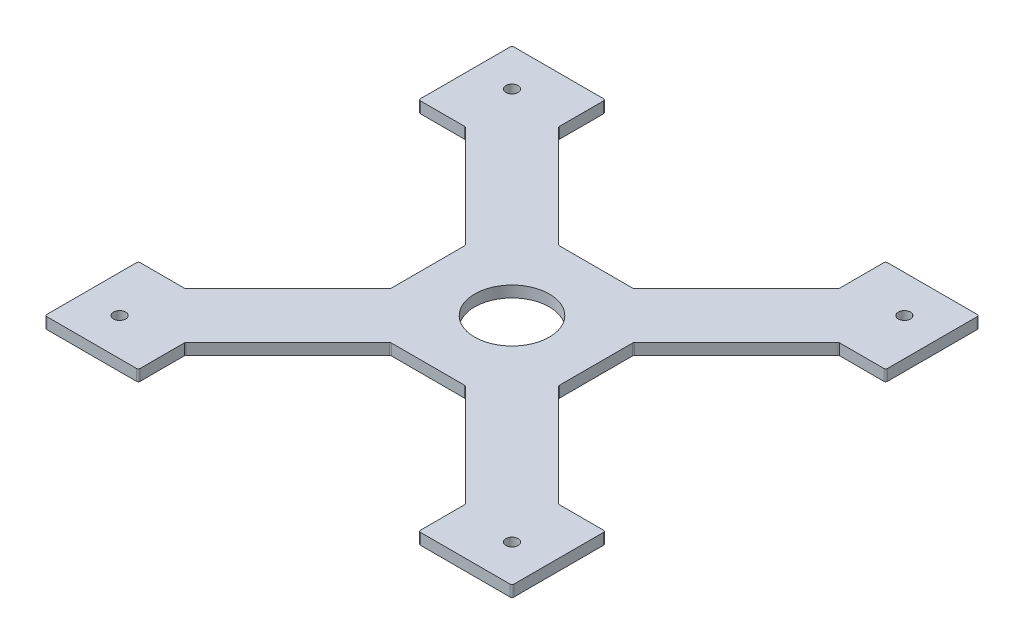
from build123d import *

# Parameters (mm, degrees)
SKETCH1_W   = 250
SKETCH1_H   = 250
TABLE_DEPTH = 6
SKETCH2_R   = 3.25
CUT_DEPTH   = 6
FILLET1_R   = 1
SKETCH3_R   = 20
LITE_DEPTH  = 354.604298616


with BuildPart() as part:
    # Sketch1 → table (new body)
    with BuildSketch(Plane(origin=(0, 0, 0), x_dir=(1, 0, 0), z_dir=(0, 1, 0))):
        with Locations((125, 125)):
            Rectangle(SKETCH1_W, SKETCH1_H)
    extrude(amount=-TABLE_DEPTH)

    # Sketch2 → cut (cut)
    with BuildSketch(Plane(origin=(0, 0, 0), x_dir=(1, 0, 0), z_dir=(0, 1, 0))):
        with Locations(Location((20, 230, 0), (0, 0, 270))):
            Circle(SKETCH2_R)
        with Locations(Location((230, 230, 0), (0, 0, 270))):
            Circle(SKETCH2_R)
        with Locations(Location((230, 20, 0), (0, 0, 270))):
            Circle(SKETCH2_R)
        with Locations(Location((20, 20, 0), (0, 0, 270))):
            Circle(SKETCH2_R)
        Polygon((0, 200), (25, 200), (80, 145), (80, 105), (25, 50), (0, 50), align=None)
        Polygon((50, 250), (50, 225), (105, 170), (145, 170), (200, 225), (200, 250), align=None)
        Polygon((250, 200), (225, 200), (170, 145), (170, 105), (225, 50), (250, 50), align=None)
        Polygon((50, 0), (50, 25), (105, 80), (145, 80), (200, 25), (200, 0), align=None)
    extrude(amount=-CUT_DEPTH, mode=Mode.SUBTRACT)

    # Fillet1
    fillet1_edges = [part.edges().sort_by_distance(p)[0] for p in [
        (0, -3, -50),
        (0, -3, -200),
        (25, -3, -200),
        (80, -3, -145),
        (80, -3, -105),
        (25, -3, -50),
        (50, -3, -250),
        (200, -3, -250),
        (200, -3, -225),
        (145, -3, -170),
        (105, -3, -170),
        (50, -3, -225),
        (250, -3, -200),
        (250, -3, -50),
        (225, -3, -50),
        (170, -3, -105),
        (170, -3, -145),
        (225, -3, -200),
        (0, -3, -250),
        (250, -3, -250),
        (250, -3, 0),
        (0, -3, 0),
        (200, -3, 0),
        (50, -3, 0),
        (50, -3, -25),
        (105, -3, -80),
        (145, -3, -80),
        (200, -3, -25),
    ]]
    fillet(fillet1_edges, radius=FILLET1_R)

    # Sketch3 → lite (cut, through all)
    with BuildSketch(Plane(origin=(0, 0, 0), x_dir=(1, 0, 0), z_dir=(0, 1, 0))):
        with Locations(Location((125, 125, 0), (0, 0, 270))):
            Circle(SKETCH3_R)
    extrude(amount=-LITE_DEPTH, mode=Mode.SUBTRACT)


solid = part.part
